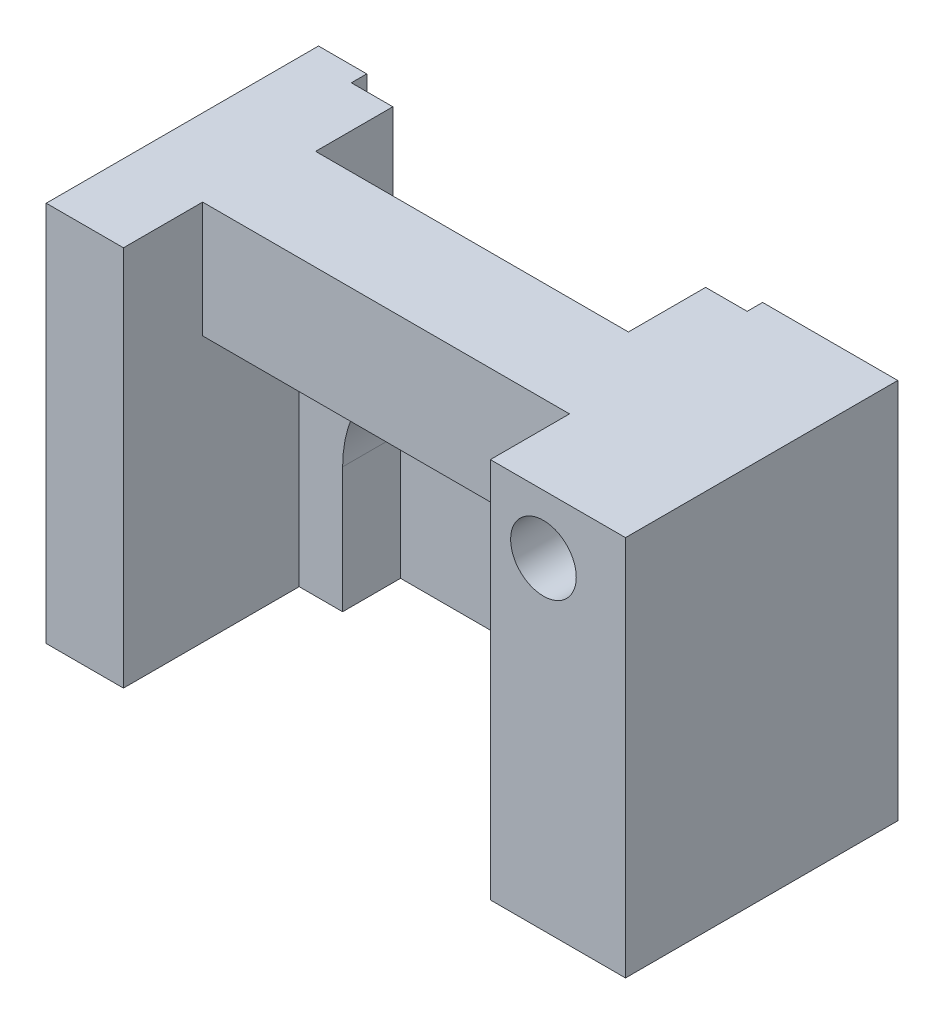
from build123d import *

# Parameters (mm, degrees)
SKETCH_1_W           = 30
SKETCH_1_H           = 24
EXTRUDE_1_DEPTH      = 10
CUT_EXTRUDE_2_DEPTH  = 0.8
M1_4X0_3_2_D         = 1.1
M1_4X0_3_2_DEPTH     = 3.7
M1_4X0_3_2_TIP       = 0.33047334
CUT_EXTRUDE_4_DEPTH  = 0.5
SKETCH_12_W          = 30
SKETCH_12_H          = 4.25
CUT_EXTRUDE_5_DEPTH  = 10
SKETCH_13_R          = 1.7
CUT_EXTRUDE_6_DEPTH  = 10
SKETCH_14_W          = 23
SKETCH_14_H          = 19.75
CUT_EXTRUDE_7_DEPTH  = 5
CUT_EXTRUDE_9_DEPTH  = 3
SKETCH_20_W          = 7
SKETCH_20_H          = 19.75
SKETCH_20_R          = 1.7
EXTRUDE_3_DEPTH      = 4.1
SKETCH_23_W          = 4
SKETCH_23_H          = 19.75
EXTRUDE_4_DEPTH      = 9.1
SKETCH_24_W          = 16.2
SKETCH_24_H          = 4.1
CUT_EXTRUDE_10_DEPTH = 4
SKETCH_25_W          = 19
SKETCH_25_H          = 6
EXTRUDE_6_DEPTH      = 5
SKETCH_28_R          = 1.15
CUT_EXTRUDE_12_DEPTH = 2


with BuildPart() as part:
    # 草图1 → 凸台-拉伸1 (new body)
    with BuildSketch(Plane.XY):
        with Locations((7.449728974, 4.736434109)):
            Rectangle(SKETCH_1_W, SKETCH_1_H)
    extrude(amount=EXTRUDE_1_DEPTH)

    # 草图2 → 切除-拉伸2 (cut)
    with BuildSketch(Plane(origin=(0, 0, 0), x_dir=(-1, 0, 0), z_dir=(0, 0, -1))):
        with BuildLine():
            Line((5.050271026, 16.736434109), (-15.449728974, 16.736434109))
            Line((-15.449728974, 16.736434109), (-15.449728974, 7.736434109))
            ThreePointArc((-15.449728974, 7.736434109), (-14.571049317, 5.615113765), (-12.449728974, 4.736434109))
            Line((-12.449728974, 4.736434109), (2.050271026, 4.736434109))
            ThreePointArc((2.050271026, 4.736434109), (4.17159137, 5.615113765), (5.050271026, 7.736434109))
            Line((5.050271026, 7.736434109), (5.050271026, 16.736434109))
        make_face()
    extrude(amount=-CUT_EXTRUDE_2_DEPTH, mode=Mode.SUBTRACT)

    # M1.4x0.3 螺纹孔2
    with Locations(Plane(origin=(0, 0, 0.8), x_dir=(-1, 0, 0), z_dir=(0, 0, -1))):
        with Locations((-12.199728974, 10.736434109), (1.800271026, 10.736434109), (-12.199728974, 7.736434109), (1.800271026, 7.736434109)):
            Hole(M1_4X0_3_2_D / 2, depth=M1_4X0_3_2_DEPTH)
            with Locations((0, 0, -(M1_4X0_3_2_DEPTH + M1_4X0_3_2_TIP / 2))):  # 118° drill point
                Cone(0, M1_4X0_3_2_D / 2, M1_4X0_3_2_TIP, mode=Mode.SUBTRACT)

    # 草图11 → 切除-拉伸4 (cut)
    with BuildSketch(Plane(origin=(0, 0, 0), x_dir=(-1, 0, 0), z_dir=(0, 0, -1))):
        with BuildLine():
            Line((-7.549728974, 1.936434109), (-2.849728974, 1.936434109))
            ThreePointArc((-2.849728974, 1.936434109), (-2.422952278, 1.759657413), (-2.599728974, 2.186434109))
            Line((-2.599728974, 2.186434109), (-2.599728974, 4.736434109))
            Line((-2.599728974, 4.736434109), (-7.799728974, 4.736434109))
            Line((-7.799728974, 4.736434109), (-7.799728974, 2.186434109))
            ThreePointArc((-7.799728974, 2.186434109), (-7.976505669, 1.759657413), (-7.549728974, 1.936434109))
        make_face()
    extrude(amount=-CUT_EXTRUDE_4_DEPTH, mode=Mode.SUBTRACT)

    # 草图12 → 切除-拉伸5 (cut)
    with BuildSketch(Plane(origin=(0, 0, 0), x_dir=(-1, 0, 0), z_dir=(0, 0, -1))):
        with Locations((-7.449728974, -5.138565891)):
            Rectangle(SKETCH_12_W, SKETCH_12_H)
    extrude(amount=-CUT_EXTRUDE_5_DEPTH, mode=Mode.SUBTRACT)

    # 草图13 → 切除-拉伸6 (cut)
    with BuildSketch(Plane(origin=(0, 0, 0), x_dir=(-1, 0, 0), z_dir=(0, 0, -1))):
        with Locations((-18.199728974, 13.686434109)):
            Circle(SKETCH_13_R)
    extrude(amount=-CUT_EXTRUDE_6_DEPTH, mode=Mode.SUBTRACT)

    # 草图14 → 切除-拉伸7 (cut)
    with BuildSketch(Plane.XY.offset(10)):
        with Locations((3.949728974, 6.861434109)):
            Rectangle(SKETCH_14_W, SKETCH_14_H)
    extrude(amount=-CUT_EXTRUDE_7_DEPTH, mode=Mode.SUBTRACT)

    # 草图16 → 切除-拉伸9 (cut)
    with BuildSketch(Plane.XY.offset(5)):
        with BuildLine():
            Line((-1.300271026, -3.013565891), (11.699728974, -3.013565891))
            Line((11.699728974, -3.013565891), (11.699728974, 3.486434109))
            ThreePointArc((11.699728974, 3.486434109), (5.199728974, 9.986434109), (-1.300271026, 3.486434109))
            Line((-1.300271026, 3.486434109), (-1.300271026, -3.013565891))
        make_face()
    extrude(amount=-CUT_EXTRUDE_9_DEPTH, mode=Mode.SUBTRACT)

    # 草图20 → 凸台-拉伸3 (add)
    with BuildSketch(Plane.XY.offset(10)):
        with Locations((18.949728974, 6.861434109)):
            Rectangle(SKETCH_20_W, SKETCH_20_H)
        with Locations((18.199728974, 13.686434109)):
            Circle(SKETCH_20_R, mode=Mode.SUBTRACT)
    extrude(amount=EXTRUDE_3_DEPTH)

    # 草图23 → 凸台-拉伸4 (add)
    with BuildSketch(Plane.XY.offset(5)):
        with Locations((-5.550271026, 6.861434109)):
            Rectangle(SKETCH_23_W, SKETCH_23_H)
    extrude(amount=EXTRUDE_4_DEPTH)

    # 草图24 → 切除-拉伸10 (cut)
    with BuildSketch(Plane(origin=(0, 0, 0.8), x_dir=(-1, 0, 0), z_dir=(0, 0, -1))):
        with Locations((-5.199728974, 14.686434109)):
            Rectangle(SKETCH_24_W, SKETCH_24_H)
    extrude(amount=-CUT_EXTRUDE_10_DEPTH, mode=Mode.SUBTRACT)

    # 草图25 → 凸台-拉伸6 (add)
    with BuildSketch(Plane.XY.offset(5)):
        with Locations((5.949728974, 13.736434109)):
            Rectangle(SKETCH_25_W, SKETCH_25_H)
    extrude(amount=EXTRUDE_6_DEPTH)

    # 草图28 → 切除-拉伸12 (cut)
    with BuildSketch(Plane(origin=(0, 0, 4.8), x_dir=(-1, 0, 0), z_dir=(0, 0, -1))):
        with Locations((-11.299728974, 14.736434109)):
            Circle(SKETCH_28_R)
        with Locations((0.900271026, 14.736434109)):
            Circle(SKETCH_28_R)
    extrude(amount=-CUT_EXTRUDE_12_DEPTH, mode=Mode.SUBTRACT)


solid = part.part
